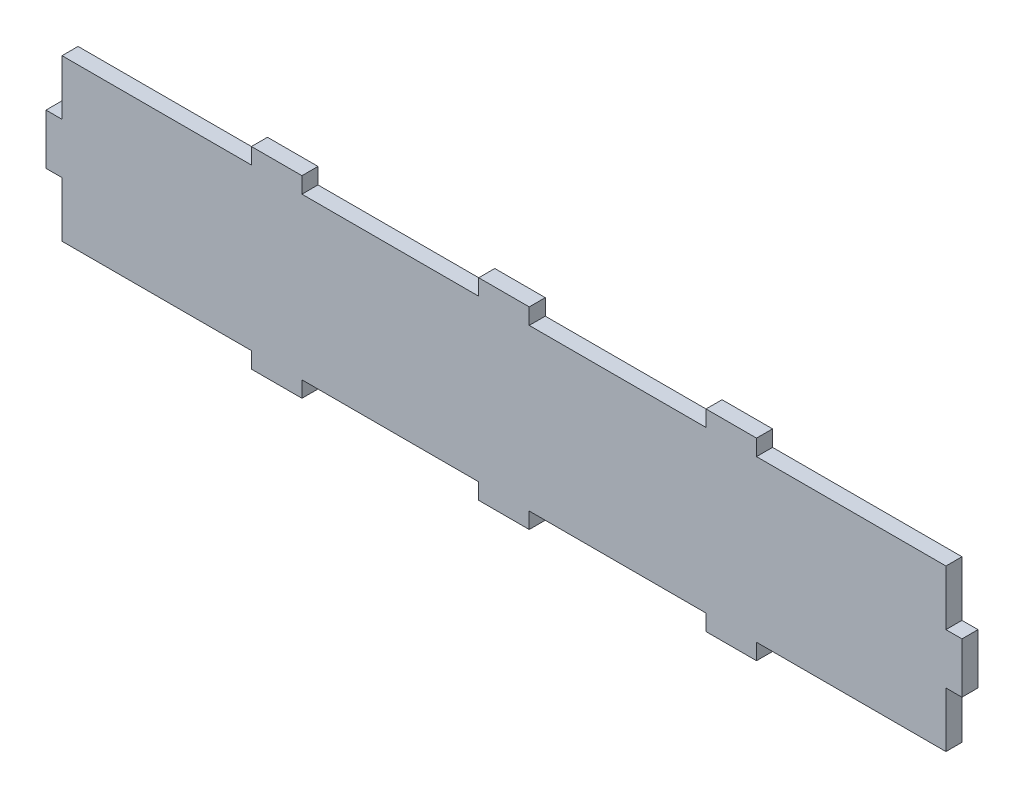
from build123d import *

# Parameters (mm, degrees)
CROQUIS1_W              = 350
CROQUIS1_H              = 63.65
SALIENTE_EXTRUIR1_DEPTH = 6.35
CROQUIS2_W              = 6.35
CROQUIS2_H              = 20
SALIENTE_EXTRUIR2_DEPTH = 6.35
CROQUIS3_W              = 20
CROQUIS3_H              = 6.35
SALIENTE_EXTRUIR3_DEPTH = 6.35


with BuildPart() as part:
    # Croquis1 → Saliente-Extruir1 (new body)
    with BuildSketch(Plane(origin=(0, 0, 0), x_dir=(-1, 0, 0), z_dir=(0, 0, 1))):
        with Locations((-18.650000026, -38.175)):
            Rectangle(CROQUIS1_W, CROQUIS1_H)
    extrude(amount=SALIENTE_EXTRUIR1_DEPTH)

    # Croquis2 → Saliente-Extruir2 (add)
    with BuildSketch(Plane.ZY.offset(156.349999974)):
        with Locations((3.175, 38.175)):
            Rectangle(CROQUIS2_W, CROQUIS2_H)
    saliente_extruir2 = extrude(amount=SALIENTE_EXTRUIR2_DEPTH)

    # Simetría1: Saliente-Extruir2 across plane
    add(saliente_extruir2.mirror(Plane(origin=(18.650000026, 0, 0), x_dir=(0, 0, 1), z_dir=(1, 0, 0))))

    # Croquis3 → Saliente-Extruir3 (add)
    with BuildSketch(Plane(origin=(0, 70, 0), x_dir=(1, 0, 0), z_dir=(0, 1, 0))):
        with Locations((18.650000026, -3.175)):
            Rectangle(CROQUIS3_W, CROQUIS3_H)
        with Locations((108.650000026, -3.175)):
            Rectangle(CROQUIS3_W, CROQUIS3_H)
        with Locations((-71.349999974, -3.175)):
            Rectangle(CROQUIS3_W, CROQUIS3_H)
    saliente_extruir3 = extrude(amount=SALIENTE_EXTRUIR3_DEPTH)

    # Simetría2: Saliente-Extruir3 across plane
    add(saliente_extruir3.mirror(Plane.ZX.offset(38.175)))


solid = part.part
